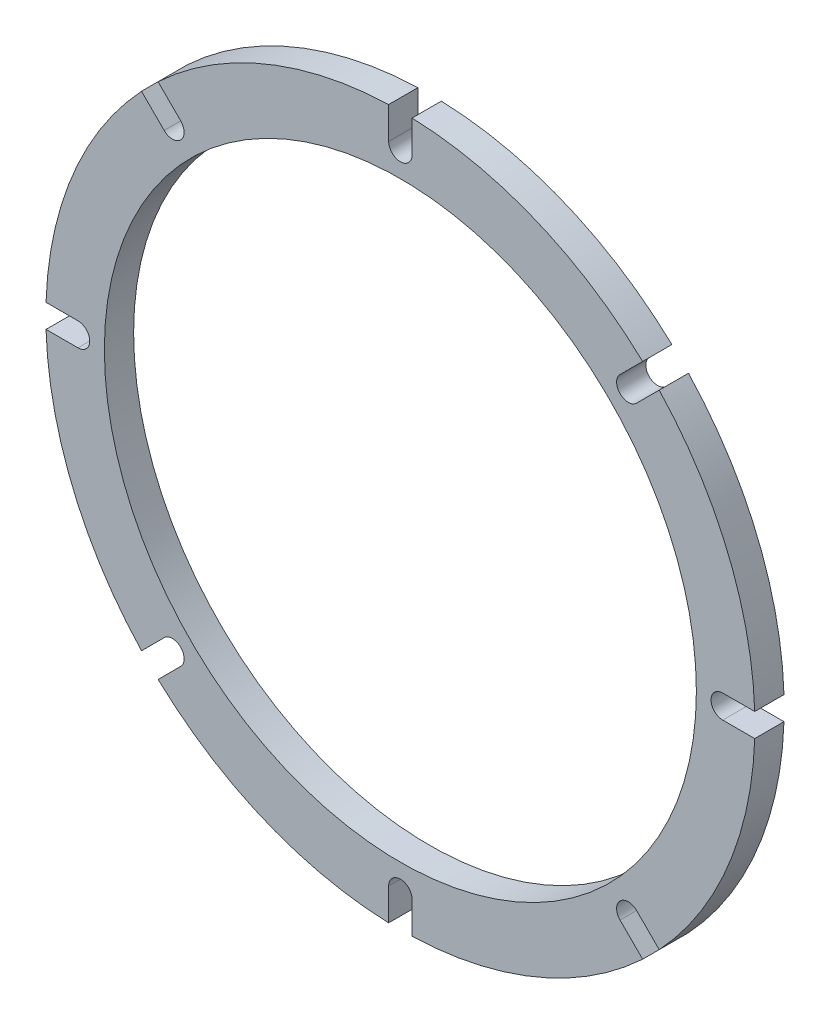
from build123d import *

# Parameters (mm, degrees)
SKETCH1_R           = 121.15
SKETCH1_R_2         = 101.15
BOSS_EXTRUDE1_DEPTH = 10
CUT_EXTRUDE1_DEPTH  = 10
CIRPATTERN1_COUNT   = 8


with BuildPart() as part:
    # Sketch1 → Boss-Extrude1 (new body)
    with BuildSketch(Plane.XY):
        Circle(SKETCH1_R)
        Circle(SKETCH1_R_2, mode=Mode.SUBTRACT)
    extrude(amount=BOSS_EXTRUDE1_DEPTH)

    # Sketch2 → Cut-Extrude1 (cut)
    with BuildSketch(Plane.XY):
        with BuildLine():
            Line((-4, 110.15), (-4, 123.851971246))
            Line((-4, 123.851971246), (4, 123.851971246))
            Line((4, 123.851971246), (4, 110.15))
            ThreePointArc((4, 110.15), (0, 106.15), (-4, 110.15))
        make_face()
    cut_extrude1 = extrude(amount=CUT_EXTRUDE1_DEPTH, mode=Mode.SUBTRACT)

    # CirPattern1: Cut-Extrude1 ×8 about axis
    cirpattern1_axis = Axis((0, 0, 0), (0, 0, 1))
    for i in range(1, CIRPATTERN1_COUNT):
        add(cut_extrude1.rotate(cirpattern1_axis, i * 360 / CIRPATTERN1_COUNT), mode=Mode.SUBTRACT)


solid = part.part
